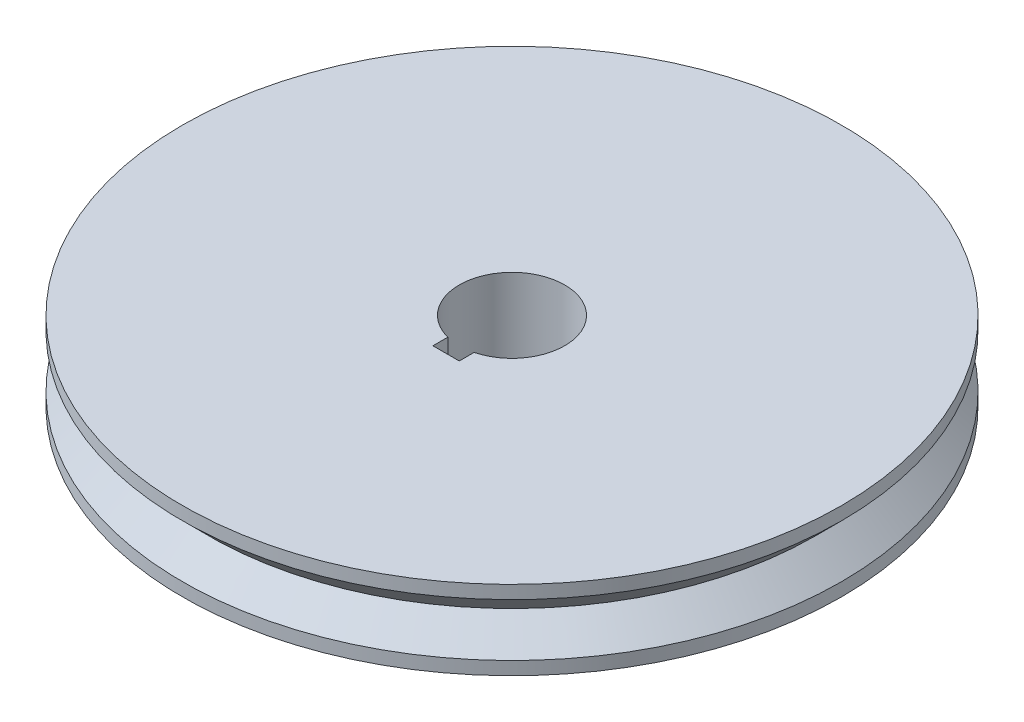
from build123d import *

# Parameters (mm, degrees)
CUT_EXTRUDE1_DEPTH = 180.30421077


with BuildPart() as part:
    # Sketch1 → Revolve1 (revolve)
    with BuildSketch(Plane.XY):
        Polygon((0, 15), (125, 15), (125, 10), (115, 0), (125, -10), (125, -15), (0, -15), align=None)
    revolve(axis=Axis((0, -15, 0), (0, -1, 0)))

    # Sketch2 → Cut-Extrude1 (cut, through all)
    with BuildSketch(Plane(origin=(0, 15, 0), x_dir=(-1, 0, 0), z_dir=(0, 1, 0))):
        with BuildLine():
            Line((-5, 19.364916731), (-5, 25))
            Line((-5, 25), (5, 25))
            Line((5, 25), (5, 19.364916731))
            ThreePointArc((5, 19.364916731), (0, -20), (-5, 19.364916731))
        make_face()
    extrude(amount=-CUT_EXTRUDE1_DEPTH, mode=Mode.SUBTRACT)


solid = part.part
